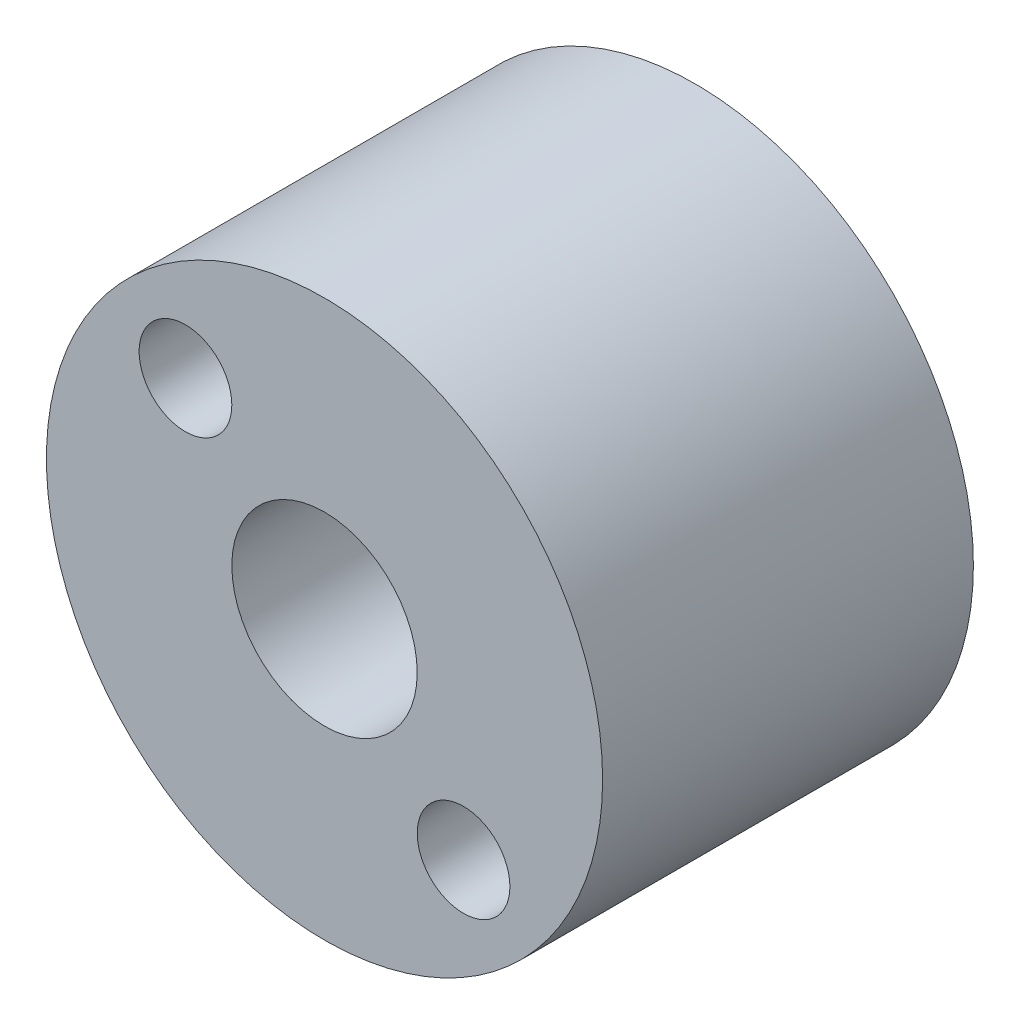
from build123d import *

# Parameters (mm, degrees)
SKIZZE2_R                        = 15
AUFSATZ_LINEAR_AUSTRAGEN1_DEPTH  = 20
F_10_0_10_DURCHMESSER_BOHRUNG1_D = 10
F_5_0_5_DURCHMESSER_BOHRUNG1_D   = 5


with BuildPart() as part:
    # Skizze2 → Aufsatz-Linear austragen1 (new body)
    with BuildSketch(Plane.XY):
        Circle(SKIZZE2_R)
    extrude(amount=AUFSATZ_LINEAR_AUSTRAGEN1_DEPTH)

    # Ø10.0 (10) Durchmesser Bohrung1 (through all)
    with Locations(Plane.XY.offset(20)):
        with Locations((0, 0)):
            Hole(F_10_0_10_DURCHMESSER_BOHRUNG1_D / 2)

    # Ø5.0 (5) Durchmesser Bohrung1 (through all)
    with Locations(Plane.XY.offset(20)):
        with Locations((-7.5, 7.5), (7.5, -7.5)):
            Hole(F_5_0_5_DURCHMESSER_BOHRUNG1_D / 2)


solid = part.part
